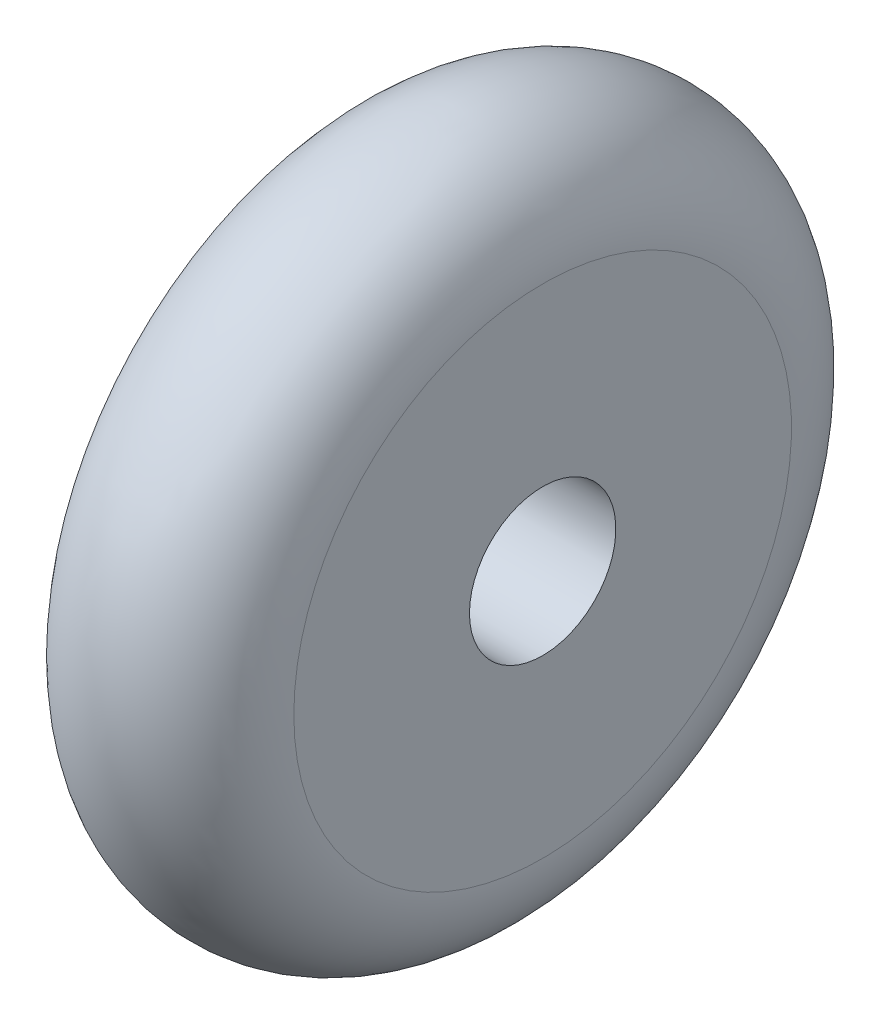
from build123d import *


with BuildPart() as part:
    # 草图1 → 旋转1 (revolve)
    with BuildSketch(Plane.XY, mode=Mode.PRIVATE) as revolve_1_sk:
        with BuildLine():
            Line((-3.5, 2.5), (3.5, 2.5))
            Line((3.5, 2.5), (3.5, 8.5))
            ThreePointArc((3.5, 8.5), (0, 12), (-3.5, 8.5))
            Line((-3.5, 8.5), (-3.5, 2.5))
        make_face()
    revolve(revolve_1_sk.sketch.rotate(Axis((-3.5, 0, 0), (1, 0, 0)), 90), axis=Axis((-3.5, 0, 0), (1, 0, 0)))


solid = part.part
